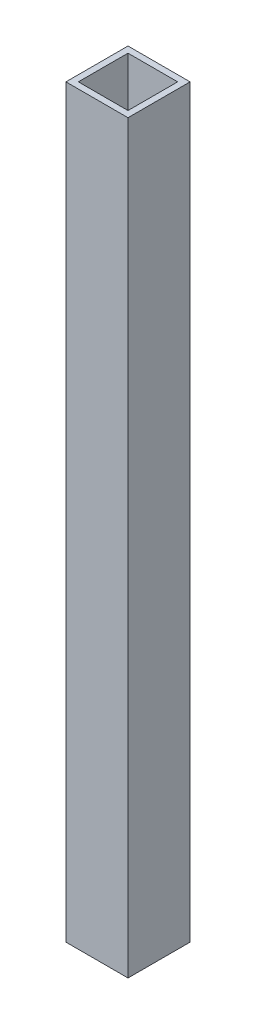
from build123d import *

# Parameters (mm, degrees)
SKETCH1_W           = 20
SKETCH1_H           = 20
SKETCH1_W_2         = 16
SKETCH1_H_2         = 16
BOSS_EXTRUDE1_DEPTH = 240


with BuildPart() as part:
    # Sketch1 → Boss-Extrude1 (new body)
    with BuildSketch(Plane(origin=(0, 0, 0), x_dir=(1, 0, 0), z_dir=(0, 1, 0))):
        Rectangle(SKETCH1_W, SKETCH1_H)
        Rectangle(SKETCH1_W_2, SKETCH1_H_2, mode=Mode.SUBTRACT)
    extrude(amount=BOSS_EXTRUDE1_DEPTH)


solid = part.part
